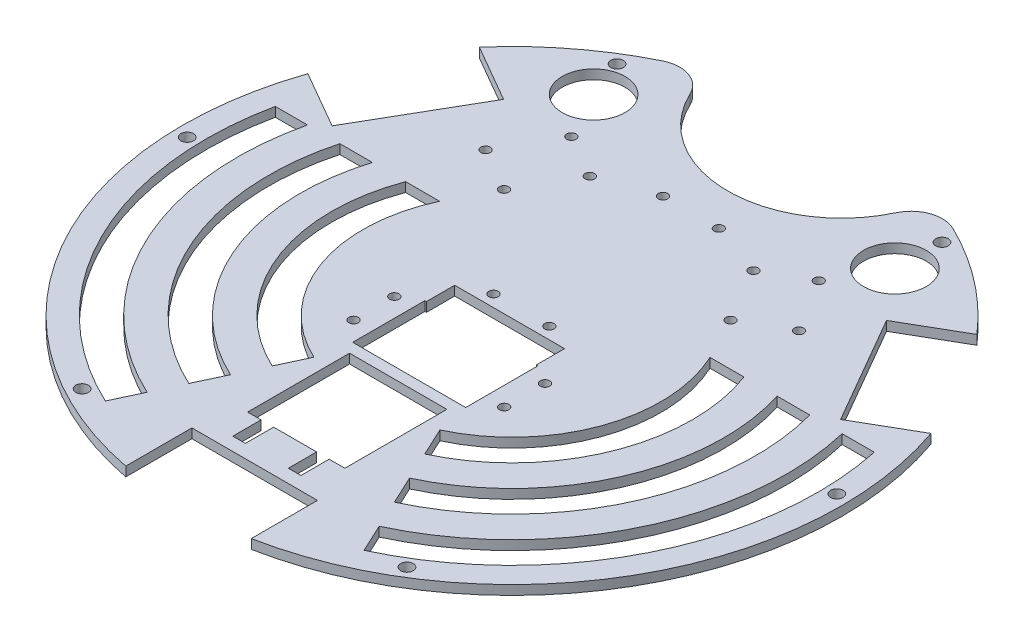
from build123d import *

# Parameters (mm, degrees)
CROQUIS1_R              = 105
SALIENTE_EXTRUIR1_DEPTH = 3
CORTAR_EXTRUIR1_START   = -3
CORTAR_EXTRUIR1_DEPTH   = 3
REDONDEO1_R             = 10
CROQUIS3_W              = 40
CROQUIS3_H              = 28
CORTAR_EXTRUIR12_DEPTH  = 149.522725677
CROQUIS12_W             = 31
CROQUIS12_H             = 32.5
CROQUIS12_W_2           = 36
CROQUIS12_H_2           = 23
CORTAR_EXTRUIR13_DEPTH  = 148.169969906
CROQUIS15_R             = 1.5
CROQUIS15_W             = 35
CROQUIS15_H             = 9
CORTAR_EXTRUIR17_DEPTH  = 148.169969906
CROQUIS16_R             = 10
CROQUIS16_R_2           = 2
CORTAR_EXTRUIR18_DEPTH  = 10
CROQUIS18_R             = 1.5
CORTAR_EXTRUIR19_DEPTH  = 148.169969906
CROQUIS19_W             = 4
CROQUIS19_H             = 9
CORTAR_EXTRUIR20_DEPTH  = 148.169969906


with BuildPart() as part:
    # Croquis1 → Saliente-Extruir1 (new body)
    with BuildSketch(Plane(origin=(0, 0, 0), x_dir=(1, 0, 0), z_dir=(0, 1, 0))):
        with Locations(Location((0, 0, 0), (0, 0, 270))):
            Circle(CROQUIS1_R)
    extrude(amount=SALIENTE_EXTRUIR1_DEPTH)

    # Croquis2 → Cortar-Extruir1 (cut)
    with BuildSketch(Plane(origin=(0, 3, 0), x_dir=(1, 0, 0), z_dir=(0, 1, 0)).offset(CORTAR_EXTRUIR1_START)):
        with BuildLine():
            ThreePointArc((35.71668902, 98.738635424), (0, 68.738635424), (-35.71668902, 98.738635424))
            ThreePointArc((-35.71668902, 98.738635424), (0, 105), (35.71668902, 98.738635424))
        make_face()
    extrude(amount=CORTAR_EXTRUIR1_DEPTH, mode=Mode.SUBTRACT)

    # Redondeo1
    redondeo1_edges = [part.edges().sort_by_distance(p)[0] for p in [
        (-35.71668902, 1.5, -98.738635424),
        (35.71668902, 1.5, -98.738635424),
    ]]
    fillet(redondeo1_edges, radius=REDONDEO1_R)

    # Croquis3 → Cortar-Extruir12 (cut, through all)
    with BuildSketch(Plane(origin=(0, 3, 0), x_dir=(1, 0, 0), z_dir=(0, 1, 0))):
        Polygon((-61.01408311, 58.320508076), (-85.262794416, 72.320508076), (-105.262794416, 37.679491924), (-81.01408311, 23.679491924), align=None)
        with Locations((0, -96)):
            Rectangle(CROQUIS3_W, CROQUIS3_H)
        Polygon((81.01408311, 23.679491924), (105.262794416, 37.679491924), (85.262794416, 72.320508076), (61.01408311, 58.320508076), align=None)
    extrude(amount=-CORTAR_EXTRUIR12_DEPTH, mode=Mode.SUBTRACT)

    # Croquis12 → Cortar-Extruir13 (cut, through all)
    with BuildSketch(Plane(origin=(0, 3, 0), x_dir=(1, 0, 0), z_dir=(0, 1, 0))):
        with Locations((0, -52.516645147)):
            Rectangle(CROQUIS12_W, CROQUIS12_H)
        with Locations((0, -21.266645147)):
            Rectangle(CROQUIS12_W_2, CROQUIS12_H_2)
    extrude(amount=-CORTAR_EXTRUIR13_DEPTH, mode=Mode.SUBTRACT)

    # Croquis15 → Cortar-Extruir17 (cut, through all)
    with BuildSketch(Plane(origin=(0, 3, 0), x_dir=(1, 0, 0), z_dir=(0, 1, 0))):
        with Locations(Location((-24, -13.496645147, 0), (0, 0, 270))):
            Circle(CROQUIS15_R)
        with Locations(Location((-24, -26.496645147, 0), (0, 0, 270))):
            Circle(CROQUIS15_R)
        with Locations(Location((24, -26.496645147, 0), (0, 0, 90))):
            Circle(CROQUIS15_R)
        with Locations(Location((24, -13.496645147, 0), (0, 0, 90))):
            Circle(CROQUIS15_R)
        with Locations(Location((-8.9, 57, 0), (0, 0, 270))):
            Circle(CROQUIS15_R)
        with Locations(Location((-8.9, 3, 0), (0, 0, 270))):
            Circle(CROQUIS15_R)
        with Locations(Location((8.9, 3, 0), (0, 0, 90))):
            Circle(CROQUIS15_R)
        with Locations(Location((8.9, 57, 0), (0, 0, 90))):
            Circle(CROQUIS15_R)
        with Locations((0, -5.266645147)):
            Rectangle(CROQUIS15_W, CROQUIS15_H)
    extrude(amount=-CORTAR_EXTRUIR17_DEPTH, mode=Mode.SUBTRACT)

    # Croquis16 → Cortar-Extruir18 (cut)
    with BuildSketch(Plane(origin=(0, 3, 0), x_dir=(1, 0, 0), z_dir=(0, 1, 0))):
        with Locations(Location((-48, 74, 0), (0, 0, 270))):
            Circle(CROQUIS16_R)
        with Locations(Location((48, 74, 0), (0, 0, 270))):
            Circle(CROQUIS16_R)
        with Locations(Location((-100.96794432, -2.544448812, 0), (0, 0, 270))):
            Circle(CROQUIS16_R_2)
        with Locations(Location((-52.68752947, 86.168580343, 0), (0, 0, 270))):
            Circle(CROQUIS16_R_2)
        with Locations(Location((48.28041485, 88.713029155, 0), (0, 0, 270))):
            Circle(CROQUIS16_R_2)
        with Locations(Location((100.96794432, 2.544448812, 0), (0, 0, 270))):
            Circle(CROQUIS16_R_2)
        with Locations(Location((52.68752947, -86.168580343, 0), (0, 0, 270))):
            Circle(CROQUIS16_R_2)
        with Locations(Location((-48.28041485, -88.713029155, 0), (0, 0, 270))):
            Circle(CROQUIS16_R_2)
        with BuildLine():
            Line((36.979097902, -79.301931366), (41.20528052, -88.365009236))
            ThreePointArc((41.20528052, -88.365009236), (87.194131202, -43.628356421), (95.42667342, 20))
            Line((95.42667342, 20), (85.183625187, 20))
            ThreePointArc((85.183625187, 20), (78.715634542, -38.211240213), (36.979097902, -79.301931366))
        make_face()
        with BuildLine():
            Line((64.468984791, 20), (74.874895659, 20))
            ThreePointArc((74.874895659, 20), (70.226057074, -32.780343314), (32.752915285, -70.238853495))
            Line((32.752915285, -70.238853495), (28.526732667, -61.175775625))
            ThreePointArc((28.526732667, -61.175775625), (61.720559812, -27.328053288), (64.468984791, 20))
        make_face()
        with BuildLine():
            Line((24.30055005, -52.112697755), (20.074367433, -43.049619884))
            ThreePointArc((20.074367433, -43.049619884), (44.621356196, -16.28448867), (43.084219849, 20))
            Line((43.084219849, 20), (53.909646632, 20))
            ThreePointArc((53.909646632, 20), (53.190873377, -21.839894445), (24.30055005, -52.112697755))
        make_face()
        with BuildLine():
            Line((-20.074367433, -43.049619884), (-24.30055005, -52.112697755))
            ThreePointArc((-24.30055005, -52.112697755), (-53.190873377, -21.839894445), (-53.909646632, 20))
            Line((-53.909646632, 20), (-43.084219849, 20))
            ThreePointArc((-43.084219849, 20), (-44.621356196, -16.28448867), (-20.074367433, -43.049619884))
        make_face()
        with BuildLine():
            Line((-28.526732667, -61.175775625), (-32.752915285, -70.238853495))
            ThreePointArc((-32.752915285, -70.238853495), (-70.226057074, -32.780343314), (-74.874895659, 20))
            Line((-74.874895659, 20), (-64.468984791, 20))
            ThreePointArc((-64.468984791, 20), (-61.720559812, -27.328053288), (-28.526732667, -61.175775625))
        make_face()
        with BuildLine():
            Line((-36.979097902, -79.301931366), (-41.20528052, -88.365009236))
            ThreePointArc((-41.20528052, -88.365009236), (-87.194131202, -43.628356421), (-95.42667342, 20))
            Line((-95.42667342, 20), (-85.183625187, 20))
            ThreePointArc((-85.183625187, 20), (-78.715634542, -38.211240213), (-36.979097902, -79.301931366))
        make_face()
    extrude(amount=-CORTAR_EXTRUIR18_DEPTH, mode=Mode.SUBTRACT)

    # Croquis18 → Cortar-Extruir19 (cut, through all)
    with BuildSketch(Plane(origin=(0, 3, 0), x_dir=(1, 0, 0), z_dir=(0, 1, 0))):
        with Locations(Location((-26.063193163, 50.851713533, 0), (0, 0, 270))):
            Circle(CROQUIS18_R)
        with Locations(Location((-39.924386076, 58.843417422, 0), (0, 0, 270))):
            Circle(CROQUIS18_R)
        with Locations(Location((-36.072108797, 33.524806485, 0), (0, 0, 270))):
            Circle(CROQUIS18_R)
        with Locations(Location((-49.933301709, 41.516510374, 0), (0, 0, 270))):
            Circle(CROQUIS18_R)
        with Locations(Location((36.072108797, 33.524806485, 0), (0, 0, 90))):
            Circle(CROQUIS18_R)
        with Locations(Location((49.933301709, 41.516510374, 0), (0, 0, 90))):
            Circle(CROQUIS18_R)
        with Locations(Location((26.063193163, 50.851713533, 0), (0, 0, 90))):
            Circle(CROQUIS18_R)
        with Locations(Location((39.27408311, 58.473890173, 0), (0, 0, 90))):
            Circle(CROQUIS18_R)
    extrude(amount=-CORTAR_EXTRUIR19_DEPTH, mode=Mode.SUBTRACT)

    # Croquis19 → Cortar-Extruir20 (cut, through all)
    with BuildSketch(Plane(origin=(0, 3, 0), x_dir=(1, 0, 0), z_dir=(0, 1, 0))):
        with Locations((-9.2, -73.266645147)):
            Rectangle(CROQUIS19_W, CROQUIS19_H)
        with Locations((8.5, -73.266645147)):
            Rectangle(CROQUIS19_W, CROQUIS19_H)
    extrude(amount=-CORTAR_EXTRUIR20_DEPTH, mode=Mode.SUBTRACT)


solid = part.part
